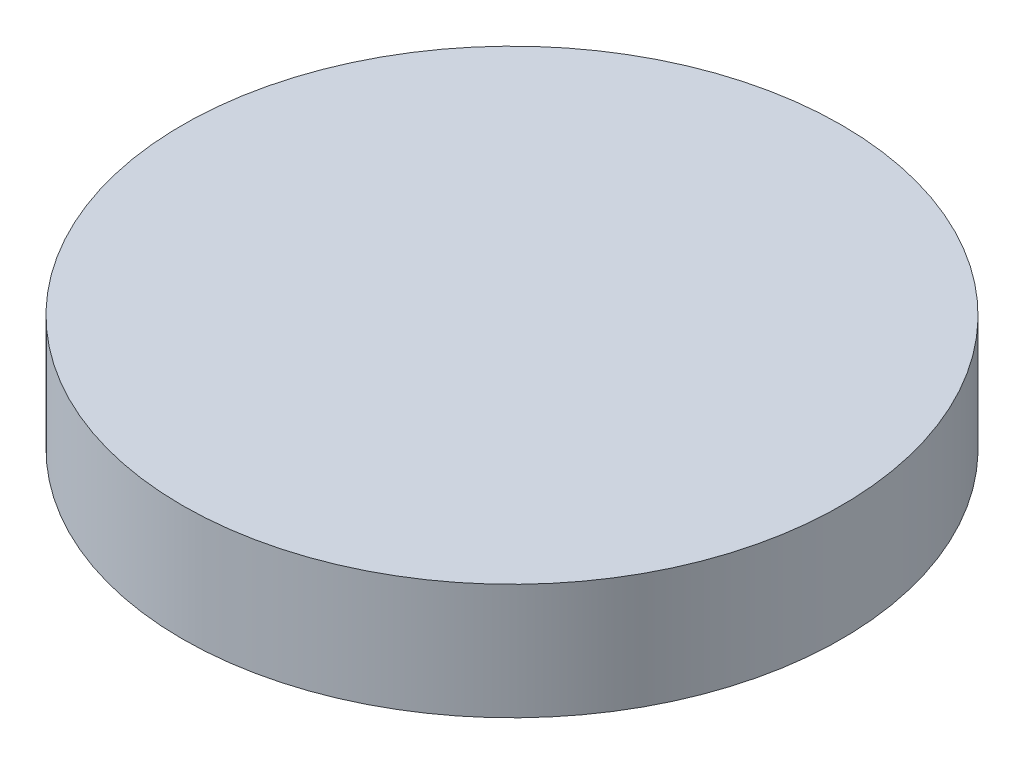
from build123d import *

# Parameters (mm, degrees)
SKETCH_1_R      = 28.5
EXTRUDE_1_DEPTH = 10


with BuildPart() as part:
    # 草图1 → 凸台-拉伸1 (new body)
    with BuildSketch(Plane(origin=(0, 0, 0), x_dir=(1, 0, 0), z_dir=(0, 1, 0))):
        with Locations(Location((0, 0, 0), (0, 0, 270))):
            Circle(SKETCH_1_R)
    extrude(amount=EXTRUDE_1_DEPTH)


solid = part.part
